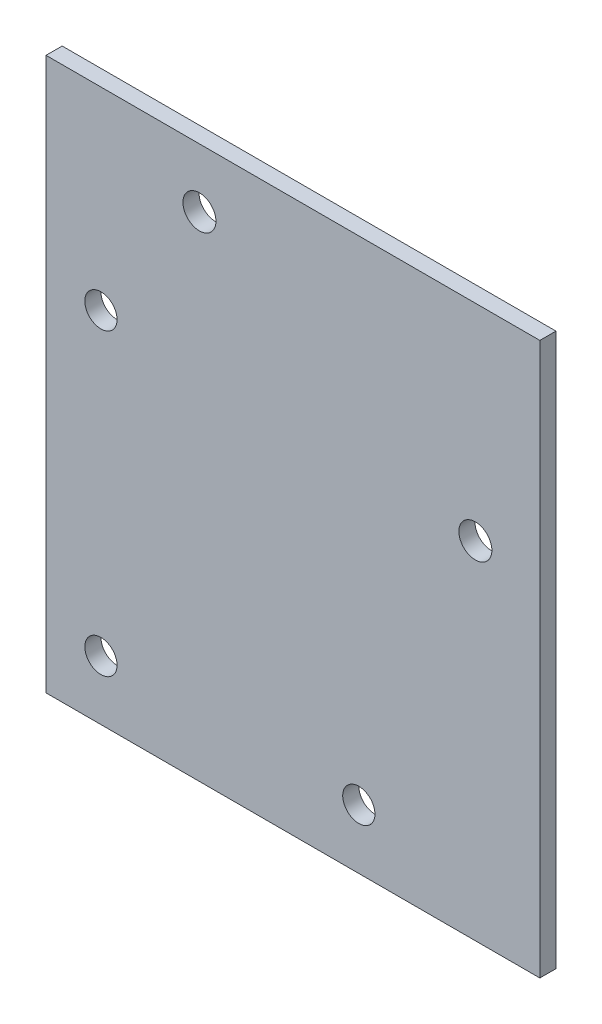
from build123d import *

# Parameters (mm, degrees)
SKETCH1_W           = 97.268504438
SKETCH1_H           = 108.769662743
SKETCH1_R           = 3.175
SKETCH1_R_2         = 3.2512
BOSS_EXTRUDE1_DEPTH = 3.175


with BuildPart() as part:
    # Sketch1 → Boss-Extrude1 (new body)
    with BuildSketch(Plane.XY):
        with Locations((-38.378931076, 219.572311485)):
            Rectangle(SKETCH1_W, SKETCH1_H)
        with Locations((-25.4, 176.892857143)):
            Circle(SKETCH1_R, mode=Mode.SUBTRACT)
        with Locations((-76.2, 176.892857143)):
            Circle(SKETCH1_R, mode=Mode.SUBTRACT)
        with Locations((-2.444678857, 233.404604576)):
            Circle(SKETCH1_R_2, mode=Mode.SUBTRACT)
        with Locations((-56.800678857, 262.360604576)):
            Circle(SKETCH1_R_2, mode=Mode.SUBTRACT)
        with Locations((-76.2, 235.857142857)):
            Circle(SKETCH1_R, mode=Mode.SUBTRACT)
    extrude(amount=BOSS_EXTRUDE1_DEPTH)


solid = part.part
